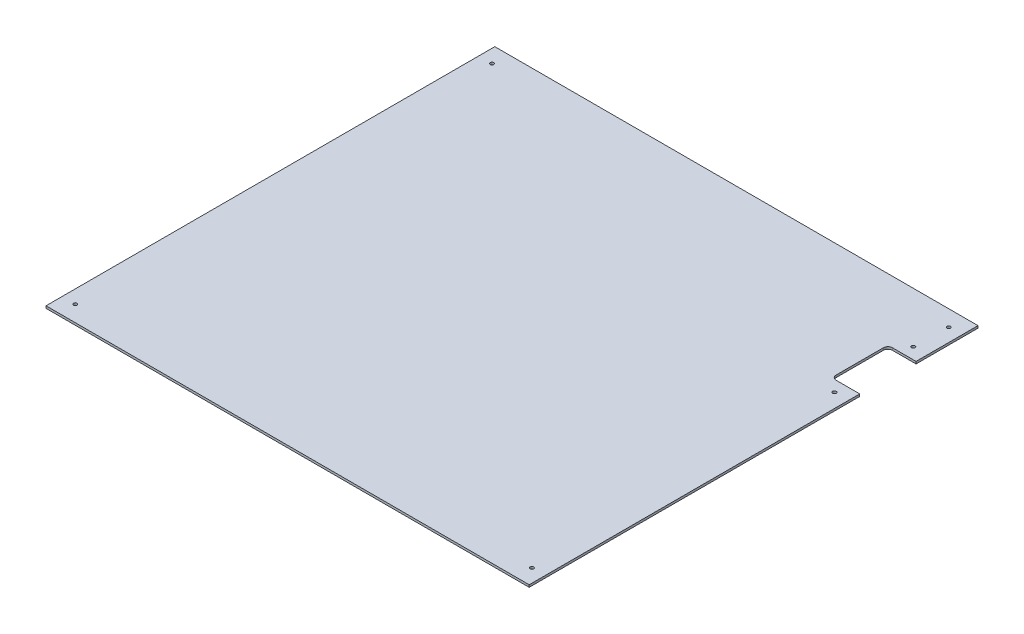
from build123d import *

# Parameters (mm, degrees)
CROQUIS1_W              = 430.5
CROQUIS1_H              = 400
SALIENTE_EXTRUIR1_DEPTH = 2
CROQUIS2_R              = 1.55
CORTAR_EXTRUIR1_DEPTH   = 2
CROQUIS3_W              = 430.5
CROQUIS3_H              = 400
CROQUIS3_W_2            = 429
CROQUIS3_H_2            = 398.5
CORTAR_EXTRUIR2_DEPTH   = 2
CROQUIS4_W              = 25
CROQUIS4_H              = 50
CORTAR_EXTRUIR3_DEPTH   = 2
REDONDEO1_R             = 4
CROQUIS5_R              = 1.6
CORTAR_EXTRUIR4_DEPTH   = 2


with BuildPart() as part:
    # Croquis1 → Saliente-Extruir1 (new body)
    with BuildSketch(Plane(origin=(0, 0, 0), x_dir=(1, 0, 0), z_dir=(0, 1, 0))):
        with Locations((215.25, 200)):
            Rectangle(CROQUIS1_W, CROQUIS1_H)
    extrude(amount=SALIENTE_EXTRUIR1_DEPTH)

    # Croquis2 → Cortar-Extruir1 (cut)
    with BuildSketch(Plane(origin=(0, 2, 0), x_dir=(1, 0, 0), z_dir=(0, 1, 0))):
        with Locations(Location((12.5, 385, 0), (0, 0, 270))):
            Circle(CROQUIS2_R)
        with Locations(Location((418, 385, 0), (0, 0, 90))):
            Circle(CROQUIS2_R)
        with Locations(Location((418, 15, 0), (0, 0, 270))):
            Circle(CROQUIS2_R)
        with Locations(Location((12.5, 15, 0), (0, 0, 90))):
            Circle(CROQUIS2_R)
    extrude(amount=-CORTAR_EXTRUIR1_DEPTH, mode=Mode.SUBTRACT)

    # Croquis3 → Cortar-Extruir2 (cut)
    with BuildSketch(Plane(origin=(0, 2, 0), x_dir=(1, 0, 0), z_dir=(0, 1, 0))):
        with Locations((215.25, 200)):
            Rectangle(CROQUIS3_W, CROQUIS3_H)
        with Locations((215.25, 200)):
            Rectangle(CROQUIS3_W_2, CROQUIS3_H_2, mode=Mode.SUBTRACT)
    extrude(amount=-CORTAR_EXTRUIR2_DEPTH, mode=Mode.SUBTRACT)

    # Croquis4 → Cortar-Extruir3 (cut)
    with BuildSketch(Plane(origin=(0, 2, 0), x_dir=(1, 0, 0), z_dir=(0, 1, 0))):
        with Locations((417.25, 319.25)):
            Rectangle(CROQUIS4_W, CROQUIS4_H)
    extrude(amount=-CORTAR_EXTRUIR3_DEPTH, mode=Mode.SUBTRACT)

    # Redondeo1
    redondeo1_edges = [part.edges().sort_by_distance(p)[0] for p in [
        (404.75, 1, -344.25),
        (404.75, 1, -294.25),
    ]]
    fillet(redondeo1_edges, radius=REDONDEO1_R)

    # Croquis5 → Cortar-Extruir4 (cut)
    with BuildSketch(Plane(origin=(0, 2, 0), x_dir=(1, 0, 0), z_dir=(0, 1, 0))):
        with Locations(Location((417.25, 354.25, 0), (0, 0, 270))):
            Circle(CROQUIS5_R)
        with Locations(Location((417.25, 284.25, 0), (0, 0, 270))):
            Circle(CROQUIS5_R)
    extrude(amount=-CORTAR_EXTRUIR4_DEPTH, mode=Mode.SUBTRACT)


solid = part.part
